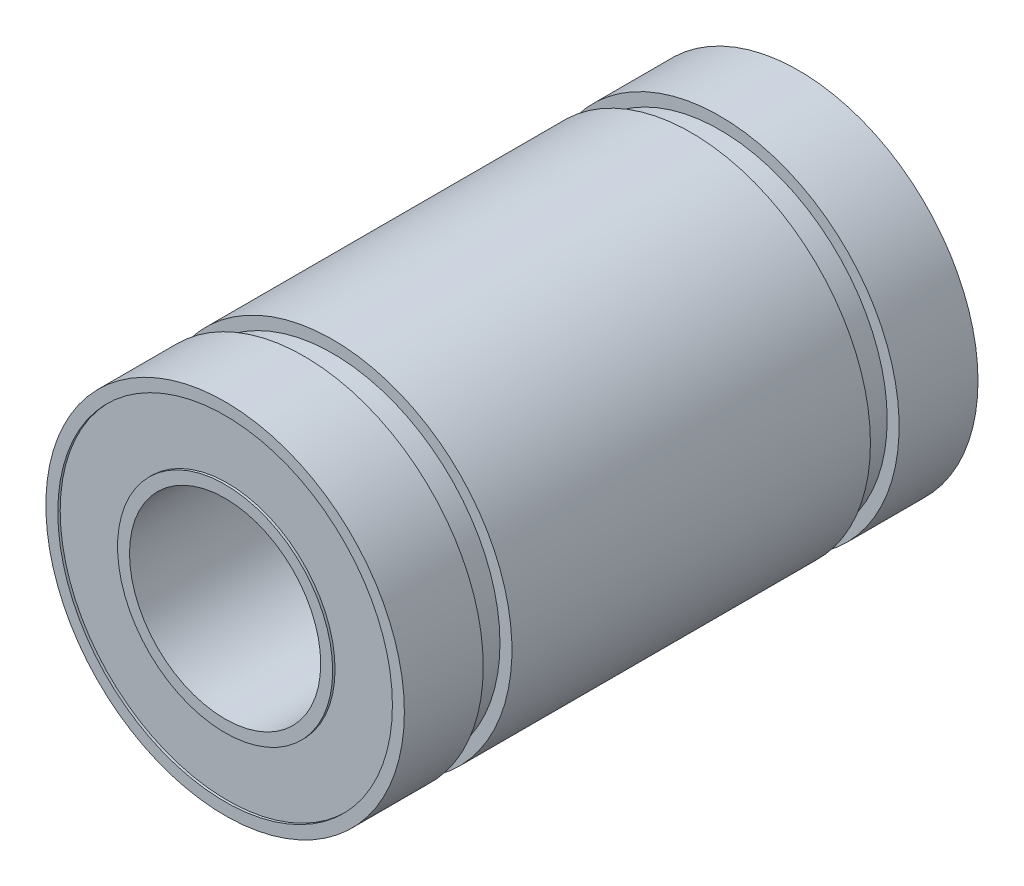
from build123d import *

# Parameters (mm, degrees)
ESBO_O1_R                = 7.5
ESBO_O1_R_2              = 4
RESSALTO_EXTRUS_O1_DEPTH = 12
ESBO_O2_R                = 7
ESBO_O2_R_2              = 4.5
CORTE_EXTRUS_O1_DEPTH    = 0.1
ESBO_O3_W                = 1.2
ESBO_O3_H                = 1


with BuildPart() as part:
    # Esboço1 → Ressalto-extrusão1 (new, symmetric)
    with BuildSketch(Plane.XY):
        Circle(ESBO_O1_R)
        Circle(ESBO_O1_R_2, mode=Mode.SUBTRACT)
    extrude(amount=RESSALTO_EXTRUS_O1_DEPTH, both=True)

    # Esboço2 → Corte-extrusão1 (cut)
    with BuildSketch(Plane.XY.offset(12)):
        Circle(ESBO_O2_R)
        Circle(ESBO_O2_R_2, mode=Mode.SUBTRACT)
    corte_extrus_o1 = extrude(amount=-CORTE_EXTRUS_O1_DEPTH, mode=Mode.SUBTRACT)

    # Espelhar1: Corte-extrusão1 across plane
    add(corte_extrus_o1.mirror(Plane.XY), mode=Mode.SUBTRACT)

    # Esboço3 → Corte-Revolução1 (revolve, cut)
    with BuildSketch(Plane(origin=(0, 0, 0), x_dir=(0, 0, -1), z_dir=(1, 0, 0)), mode=Mode.PRIVATE) as corte_revolu_o1_sk:
        with Locations((-8.1, 7.5)):
            Rectangle(ESBO_O3_W, ESBO_O3_H)
        with Locations((8.1, 7.5)):
            Rectangle(ESBO_O3_W, ESBO_O3_H)
    revolve(corte_revolu_o1_sk.sketch.rotate(Axis((0, 0, 0), (0, 0, 1)), 90), axis=Axis((0, 0, 0), (0, 0, 1)), mode=Mode.SUBTRACT)


solid = part.part
